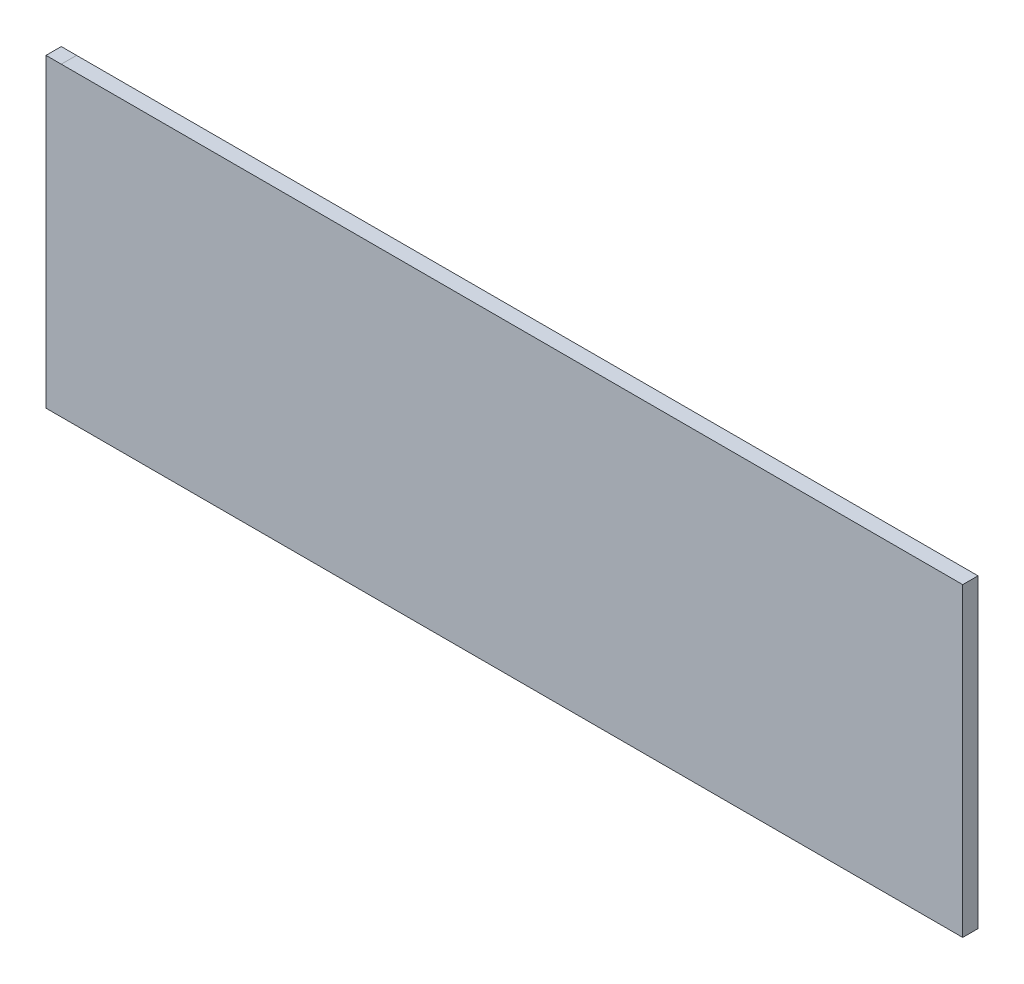
from build123d import *

# Parameters (mm, degrees)
SKETCH1_W           = 1200
SKETCH1_H           = 400
BOSS_EXTRUDE1_DEPTH = 20


with BuildPart() as part:
    # Sketch1 → Boss-Extrude1 (new body)
    with BuildSketch(Plane.XY):
        with Locations((600, 200)):
            Rectangle(SKETCH1_W, SKETCH1_H)
    extrude(amount=BOSS_EXTRUDE1_DEPTH)


solid = part.part
